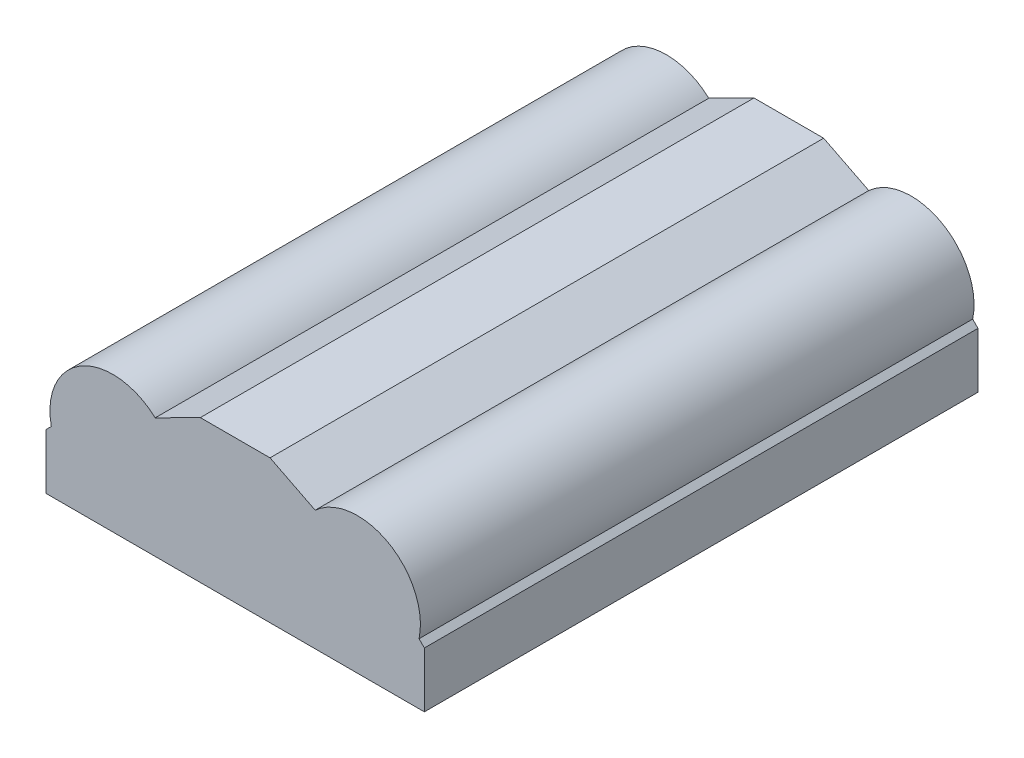
from build123d import *

# Parameters (mm, degrees)
SKETCH1_W           = 190
SKETCH1_H           = 278
BOSS_EXTRUDE1_DEPTH = 105
SKETCH3_OUTSIDE_W   = 262.544
SKETCH3_OUTSIDE_H   = 177.544
CUT_EXTRUDE1_DEPTH  = 353.71660012


with BuildPart() as part:
    # Sketch1 → Boss-Extrude1 (new body)
    with BuildSketch(Plane(origin=(0, 0, 0), x_dir=(1, 0, 0), z_dir=(0, 1, 0))):
        with Locations((95, 139)):
            Rectangle(SKETCH1_W, SKETCH1_H)
    extrude(amount=BOSS_EXTRUDE1_DEPTH)

    # Sketch3 outside → Cut-Extrude1 (cut, through all)
    with BuildSketch(Plane.XY):
        with Locations((95, 52.5)):
            Rectangle(SKETCH3_OUTSIDE_W, SKETCH3_OUTSIDE_H)
        with BuildLine():
            Line((54.836273007, 60.288293162), (77.499520746, 71.724132439))
            Line((77.499520746, 71.724132439), (112.500479254, 71.724132439))
            Line((112.500479254, 71.724132439), (135.163726993, 60.288293162))
            ThreePointArc((135.163726993, 60.288293162), (172.119968318, 64.39962656), (187.325162615, 30.466325783))
            Line((187.325162615, 30.466325783), (190, 27.791488398))
            Line((190, 27.791488398), (190, 0))
            Line((190, 0), (0, 0))
            Line((0, 0), (0, 27.791488398))
            Line((0, 27.791488398), (2.674837385, 30.466325783))
            ThreePointArc((2.674837385, 30.466325783), (17.880031682, 64.39962656), (54.836273007, 60.288293162))
        make_face(mode=Mode.SUBTRACT)
    extrude(amount=-CUT_EXTRUDE1_DEPTH, mode=Mode.SUBTRACT)


solid = part.part
